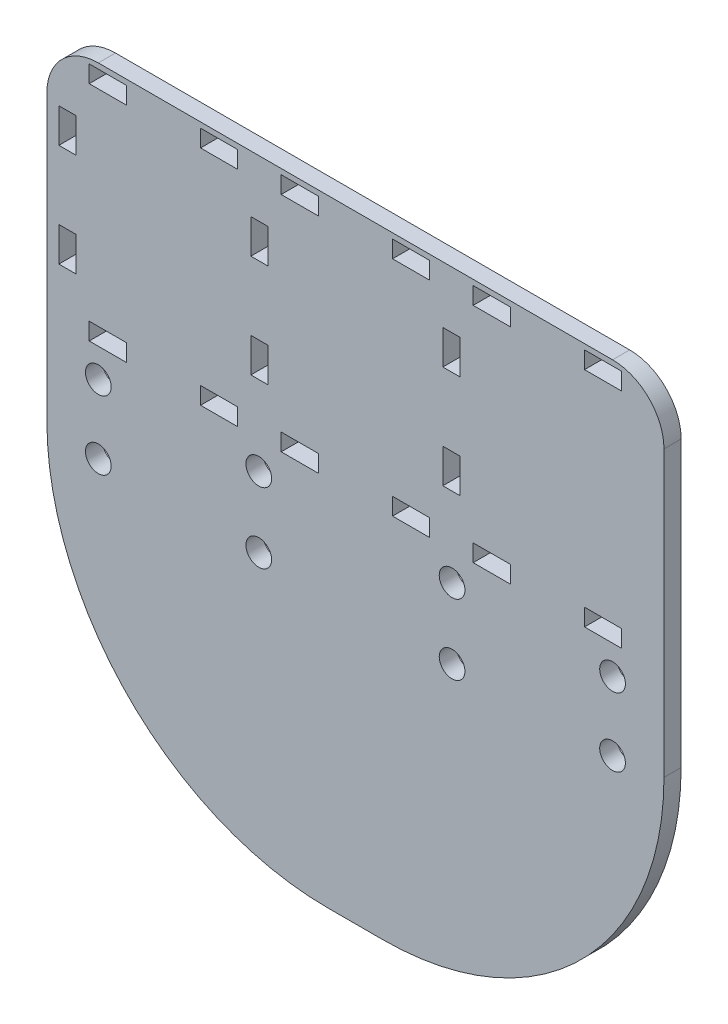
from build123d import *

# Parameters (mm, degrees)
SKETCH1_W               = 228.6
SKETCH1_H               = 228.6
BOSS_EXTRUDE1_DEPTH     = 6.35
CUT_EXTRUDE1_DEPTH      = 324.351577234
CUT_EXTRUDE1_DEPTH_BACK = 324.351577234
SKETCH2_W               = 13.749999996
SKETCH2_H               = 6.35
SKETCH2_W_2             = 13.749999995
CUT_EXTRUDE2_DEPTH      = 324.351577234
CUT_EXTRUDE2_DEPTH_BACK = 324.351577234
SKETCH3_R               = 4.7625
FILLET1_R               = 19.05
FILLET2_R               = 104.14
CUT_EXTRUDE3_DEPTH      = 324.351577234
CUT_EXTRUDE3_DEPTH_BACK = 324.351577234
SKETCH4_W               = 6.35
SKETCH4_H               = 12.7
CUT_EXTRUDE4_DEPTH      = 324.351577234
CUT_EXTRUDE4_DEPTH_BACK = 324.351577234
SKETCH5_R               = 4.7625


with BuildPart() as part:
    # Sketch1 → Boss-Extrude1 (new body)
    with BuildSketch(Plane.XY):
        with Locations((114.3, 114.3)):
            Rectangle(SKETCH1_W, SKETCH1_H)
    extrude(amount=BOSS_EXTRUDE1_DEPTH)

    # Sketch2 → Cut-Extrude1 (cut, two sides: drawn at the far end of the back side and taken through both)
    with BuildSketch(Plane.XY.offset(6.35).offset(-CUT_EXTRUDE1_DEPTH_BACK)):
        with Locations((134.924999993, 223.424999936)):
            Rectangle(SKETCH2_W, SKETCH2_H)
        with Locations((93.675000006, 223.424999936)):
            Rectangle(SKETCH2_W_2, SKETCH2_H)
        with Locations((206.044999993, 223.424999936)):
            Rectangle(SKETCH2_W, SKETCH2_H)
        with Locations((164.795000007, 223.424999936)):
            Rectangle(SKETCH2_W_2, SKETCH2_H)
        with Locations((22.555000007, 223.424999936)):
            Rectangle(SKETCH2_W_2, SKETCH2_H)
        with Locations((63.804999993, 223.424999936)):
            Rectangle(SKETCH2_W, SKETCH2_H)
        with Locations((206.044999993, 140.874999936)):
            Rectangle(SKETCH2_W, SKETCH2_H)
        with Locations((164.795000007, 140.874999936)):
            Rectangle(SKETCH2_W_2, SKETCH2_H)
        with Locations((134.924999993, 140.874999936)):
            Rectangle(SKETCH2_W, SKETCH2_H)
        with Locations((93.675000006, 140.874999936)):
            Rectangle(SKETCH2_W_2, SKETCH2_H)
        with Locations((63.804999993, 140.874999936)):
            Rectangle(SKETCH2_W, SKETCH2_H)
        with Locations((22.555000007, 140.874999936)):
            Rectangle(SKETCH2_W, SKETCH2_H)
    extrude(amount=CUT_EXTRUDE1_DEPTH + CUT_EXTRUDE1_DEPTH_BACK, mode=Mode.SUBTRACT)

    # Sketch3 → Cut-Extrude2 (cut, two sides: drawn at the far end of the back side and taken through both)
    with BuildSketch(Plane.XY.offset(6.35).offset(-CUT_EXTRUDE2_DEPTH_BACK)):
        with Locations((19.05, 127)):
            Circle(SKETCH3_R)
        with Locations(Location((19.05, 101.6, 0), (0, 0, 180))):
            Circle(SKETCH3_R)
        with Locations((209.55, 101.6)):
            Circle(SKETCH3_R)
        with Locations(Location((209.55, 127, 0), (0, 0, 180))):
            Circle(SKETCH3_R)
    extrude(amount=CUT_EXTRUDE2_DEPTH + CUT_EXTRUDE2_DEPTH_BACK, mode=Mode.SUBTRACT)

    # Fillet1
    fillet1_edges = [part.edges().sort_by_distance(p)[0] for p in [
        (0, 228.6, 3.175),
        (228.6, 228.6, 3.175),
    ]]
    fillet(fillet1_edges, radius=FILLET1_R)

    # Fillet2
    fillet2_edges = [part.edges().sort_by_distance(p)[0] for p in [
        (228.6, 0, 3.175),
        (0, 0, 3.175),
    ]]
    fillet(fillet2_edges, radius=FILLET2_R)

    # Sketch4 → Cut-Extrude3 (cut, two sides: drawn at the far end of the back side and taken through both)
    with BuildSketch(Plane.XY.offset(6.35).offset(-CUT_EXTRUDE3_DEPTH_BACK)):
        with Locations((78.74, 201.199999936)):
            Rectangle(SKETCH4_W, SKETCH4_H)
        with Locations((78.74, 163.099999936)):
            Rectangle(SKETCH4_W, SKETCH4_H)
        with Locations((149.86, 163.099999936)):
            Rectangle(SKETCH4_W, SKETCH4_H)
        with Locations((149.86, 201.199999936)):
            Rectangle(SKETCH4_W, SKETCH4_H)
        with Locations((7.62, 163.099999936)):
            Rectangle(SKETCH4_W, SKETCH4_H)
        with Locations((7.62, 201.199999936)):
            Rectangle(SKETCH4_W, SKETCH4_H)
    extrude(amount=CUT_EXTRUDE3_DEPTH + CUT_EXTRUDE3_DEPTH_BACK, mode=Mode.SUBTRACT)

    # Sketch5 → Cut-Extrude4 (cut, two sides: drawn at the far end of the back side and taken through both)
    with BuildSketch(Plane.XY.offset(6.35).offset(-CUT_EXTRUDE4_DEPTH_BACK)):
        with Locations((78.497711148, 127.330967461)):
            Circle(SKETCH5_R)
        with Locations(Location((150.102288852, 127.330967461, 0), (0, 0, 180))):
            Circle(SKETCH5_R)
        with Locations((150.102288852, 101.269032539)):
            Circle(SKETCH5_R)
        with Locations(Location((78.497711148, 101.269032539, 0), (0, 0, 180))):
            Circle(SKETCH5_R)
    extrude(amount=CUT_EXTRUDE4_DEPTH + CUT_EXTRUDE4_DEPTH_BACK, mode=Mode.SUBTRACT)


solid = part.part
